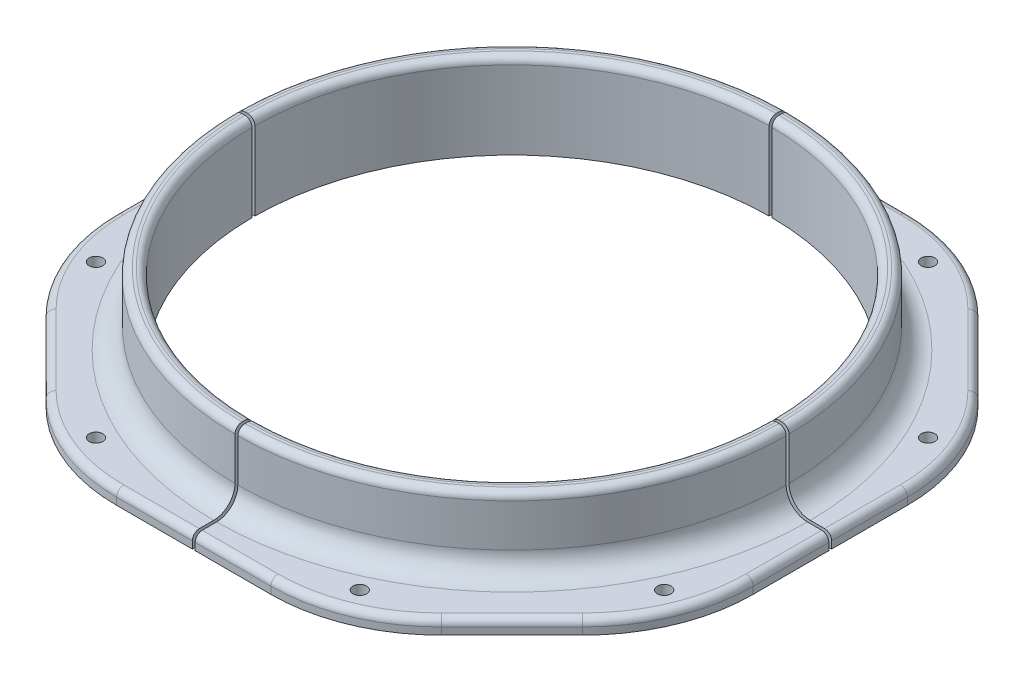
from build123d import *

# Parameters (mm, degrees)
SKETCH1_R           = 123.19
SKETCH1_R_2         = 115.57
BOSS_EXTRUDE1_DEPTH = 38.1
SKETCH2_W           = 284.48
SKETCH2_H           = 284.48
SKETCH2_R           = 123.19
BOSS_EXTRUDE2_DEPTH = 6.35
CHAMFER1_SIZE       = 76.2
SKETCH3_R           = 3.048
CUT_EXTRUDE1_DEPTH  = 204.647974947
CIRPATTERN1_COUNT   = 4
FILLET1_R           = 9.525
FILLET2_R           = 76.2
FILLET3_R           = 3.175
FILLET4_R           = 3.175
CUT_EXTRUDE2_DEPTH  = 205.734084137


with BuildPart() as part:
    # Sketch1 → Boss-Extrude1 (new body)
    with BuildSketch(Plane(origin=(0, 0, 0), x_dir=(1, 0, 0), z_dir=(0, 1, 0))):
        with Locations(Location((0, 0, 0), (0, 0, 90))):
            Circle(SKETCH1_R)
        with Locations(Location((0, 0, 0), (0, 0, 90))):
            Circle(SKETCH1_R_2, mode=Mode.SUBTRACT)
    extrude(amount=BOSS_EXTRUDE1_DEPTH)

    # Sketch2 → Boss-Extrude2 (add)
    with BuildSketch(Plane.XZ):
        Rectangle(SKETCH2_W, SKETCH2_H)
        with Locations(Location((0, 0, 0), (0, 0, 270))):
            Circle(SKETCH2_R, mode=Mode.SUBTRACT)
    extrude(amount=-BOSS_EXTRUDE2_DEPTH)

    # Chamfer1
    chamfer1_edges = [part.edges().sort_by_distance(p)[0] for p in [
        (142.24, 3.175, 142.24),
        (142.24, 3.175, -142.24),
        (-142.24, 3.175, -142.24),
        (-142.24, 3.175, 142.24),
    ]]
    chamfer(chamfer1_edges, length=CHAMFER1_SIZE)

    # Sketch3 → Cut-Extrude1 (cut, through all)
    with BuildSketch(Plane(origin=(0, 6.35, 0), x_dir=(1, 0, 0), z_dir=(0, 1, 0))):
        with Locations(Location((58.958350921, -126.987217368, 0), (0, 0, 270))):
            Circle(SKETCH3_R)
        with Locations(Location((126.987217368, -58.958350921, 0), (0, 0, 270))):
            Circle(SKETCH3_R)
    cut_extrude1 = extrude(amount=-CUT_EXTRUDE1_DEPTH, mode=Mode.SUBTRACT)

    # CirPattern1: Cut-Extrude1 ×4 about axis
    cirpattern1_axis = Axis((0, 0, 0), (0, 1, 0))
    for i in range(1, CIRPATTERN1_COUNT):
        add(cut_extrude1.rotate(cirpattern1_axis, i * 360 / CIRPATTERN1_COUNT), mode=Mode.SUBTRACT)

    # Fillet1
    fillet1_edges = [part.edges().sort_by_distance(p)[0] for p in [
        (0, 6.35, 123.19),
    ]]
    fillet(fillet1_edges, radius=FILLET1_R)

    # Fillet2
    fillet2_edges = [part.edges().sort_by_distance(p)[0] for p in [
        (-142.24, 3.175, 66.04),
        (-142.24, 3.175, -66.04),
        (66.04, 3.175, -142.24),
        (-66.04, 3.175, -142.24),
        (142.24, 3.175, 66.04),
        (142.24, 3.175, -66.04),
        (-66.04, 3.175, 142.24),
        (66.04, 3.175, 142.24),
    ]]
    fillet(fillet2_edges, radius=FILLET2_R)

    # Fillet3
    fillet3_edges = [part.edges().sort_by_distance(p)[0] for p in [
        (0, 38.1, 123.19),
        (0, 38.1, 115.57),
    ]]
    fillet(fillet3_edges, radius=FILLET3_R)

    # Fillet4
    fillet4_edges = [part.edges().sort_by_distance(p)[0] for p in [
        (0, 6.35, -142.24),
        (-104.14, 6.35, 104.14),
        (0, 6.35, 142.24),
        (104.14, 6.35, 104.14),
        (142.24, 6.35, 0),
        (104.14, 6.35, -104.14),
        (-136.439620377, 6.35, 63.637404093),
        (-63.637404093, 6.35, 136.439620377),
        (63.637404093, 6.35, 136.439620377),
        (136.439620377, 6.35, 63.637404093),
        (136.439620377, 6.35, -63.637404093),
        (63.637404093, 6.35, -136.439620377),
        (-63.637404093, 6.35, -136.439620377),
        (-136.439620377, 6.35, -63.637404093),
        (-142.24, 6.35, 0),
        (-104.14, 6.35, -104.14),
    ]]
    fillet(fillet4_edges, radius=FILLET4_R)

    # Sketch4 → Cut-Extrude2 (cut, through all)
    with BuildSketch(Plane.XZ):
        Polygon((0.635, -171.604714128), (0.635, -0.635), (194.367947329, -0.635), (194.367947329, 0.635), (0.635, 0.635), (0.635, 187.171732047), (-0.635, 187.171732047), (-0.635, 0.635), (-167.974838284, 0.635), (-167.974838284, -0.635), (-0.635, -0.635), (-0.635, -171.604714128), align=None)
    extrude(amount=-CUT_EXTRUDE2_DEPTH, mode=Mode.SUBTRACT)


with BuildPart() as cut_extrude2_piece_1:
    # of the separate pieces the step leaves, piece 1, a body of its own (cut_extrude2_pieces)
    add(part.part.solids().sort_by_distance((-86.113399243, 6.35, -117.676472696))[0])


with BuildPart() as cut_extrude2_piece_2:
    # of the separate pieces the step leaves, piece 2, a body of its own (cut_extrude2_pieces)
    add(part.part.solids().sort_by_distance((-132.713480853, 6.35, 0.635))[0])


with BuildPart() as cut_extrude2_piece_3:
    # of the separate pieces the step leaves, piece 3, a body of its own (cut_extrude2_pieces)
    add(part.part.solids().sort_by_distance((0.635, 6.35, -139.065))[0])


with BuildPart() as cut_extrude2_piece_4:
    # of the separate pieces the step leaves, piece 4, a body of its own (cut_extrude2_pieces)
    add(part.part.solids().sort_by_distance((132.713480853, 6.35, 0.635))[0])


solid = Compound([cut_extrude2_piece_1.part, cut_extrude2_piece_2.part, cut_extrude2_piece_3.part, cut_extrude2_piece_4.part])
